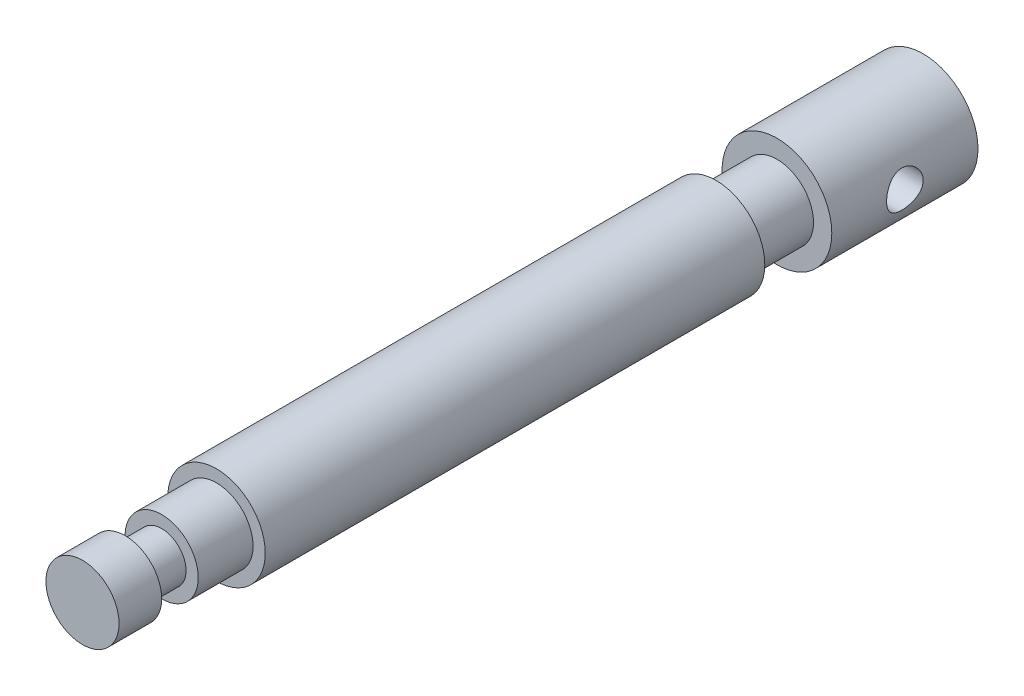
from build123d import *

# Parameters (mm, degrees)
CUT_EXTRUDE1_DEPTH      = 72.345331129
CUT_EXTRUDE1_DEPTH_BACK = 72.345331129
SKETCH2_R               = 3


with BuildPart() as part:
    # Sketch1 → Revolve1 (revolve)
    with BuildSketch(Plane(origin=(0, 0, 0), x_dir=(0, 0, -1), z_dir=(1, 0, 0)), mode=Mode.PRIVATE) as revolve1_sk:
        Polygon((-48.200828157, 8), (33.799171843, 8), (33.799171843, 6), (43.799171843, 6), (43.799171843, 9), (67.799171843, 9), (67.799171843, 0), (-70.200828157, 0), (-70.200828157, 6), (-63.200828157, 6), (-63.200828157, 4), (-57.200828157, 4), (-57.200828157, 6), (-48.200828157, 6), align=None)
    revolve(revolve1_sk.sketch.rotate(Axis((0, 0, 78.34989648), (0, 0, -1)), 90), axis=Axis((0, 0, 78.34989648), (0, 0, -1)))

    # Sketch2 → Cut-Extrude1 (cut, two sides: drawn at the far end of the back side and taken through both)
    with BuildSketch(Plane(origin=(0, 0, 0), x_dir=(0, 0, -1), z_dir=(1, 0, 0)).offset(-CUT_EXTRUDE1_DEPTH_BACK)):
        with Locations((55.799171843, 0)):
            Circle(SKETCH2_R)
    extrude(amount=CUT_EXTRUDE1_DEPTH + CUT_EXTRUDE1_DEPTH_BACK, mode=Mode.SUBTRACT)


solid = part.part
